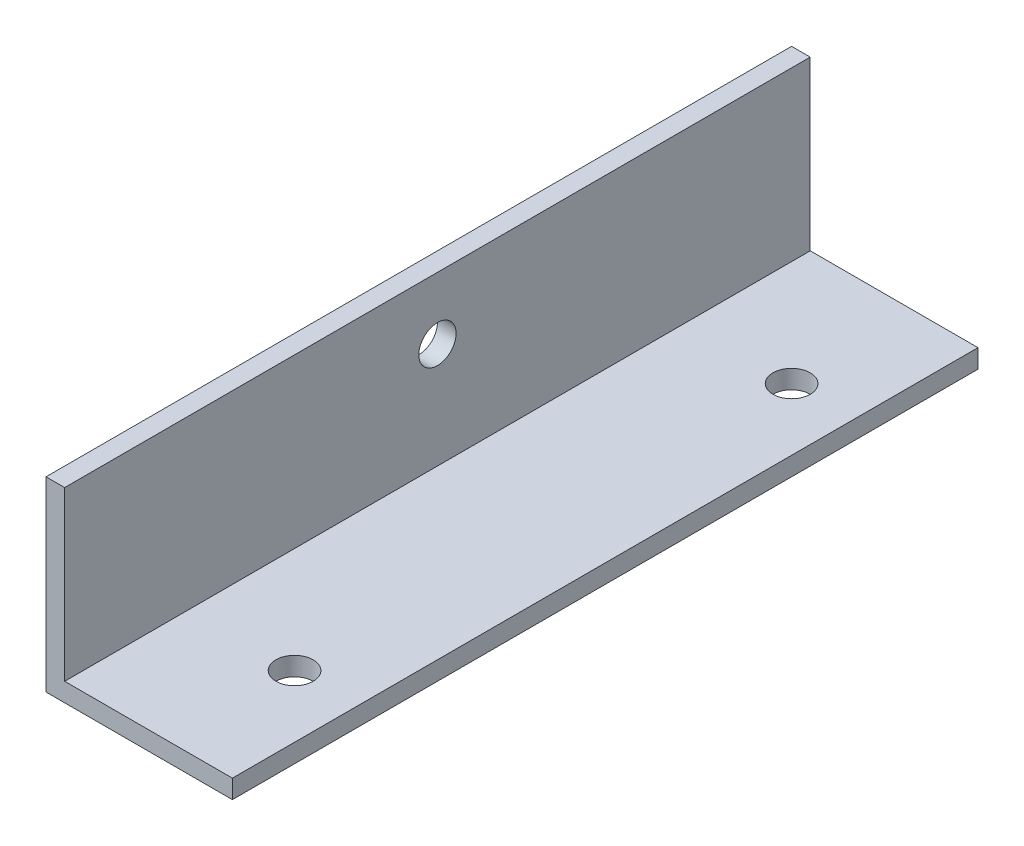
from build123d import *

# Parameters (mm, degrees)
EXTRUSION1_DEPTH           = 60
ESQUISSE2_R                = 1.5
EXTRUSION2_DEPTH           = 60
ESQUISSE3_R                = 1.5
EXTRUSION3_DEPTH           = 60
R_P_TITION_LIN_AIRE1_COUNT = 2
R_P_TITION_LIN_AIRE1_PITCH = 40


with BuildPart() as part:
    # Esquisse1 → Extrusion1 (new body)
    with BuildSketch(Plane.XY):
        Polygon((0, 0), (1.5, 0), (15, 0), (15, 1.5), (1.5, 1.5), (1.5, 15), (0, 15), align=None)
    extrude(amount=EXTRUSION1_DEPTH)

    # Esquisse2 → Extrusion2 (cut)
    with BuildSketch(Plane.ZY):
        with Locations((30, 10)):
            Circle(ESQUISSE2_R)
    extrude(amount=-EXTRUSION2_DEPTH, mode=Mode.SUBTRACT)

    # Esquisse3 → Extrusion3 (cut)
    with BuildSketch(Plane.XZ):
        with Locations(Location((10, 10, 0), (0, 0, 270))):
            Circle(ESQUISSE3_R)
    extrusion3 = extrude(amount=-EXTRUSION3_DEPTH, mode=Mode.SUBTRACT)

    # Répétition linéaire1: Extrusion3 ×2
    with Locations(*[(0, 0, i * R_P_TITION_LIN_AIRE1_PITCH) for i in range(1, R_P_TITION_LIN_AIRE1_COUNT)]):
        add(extrusion3, mode=Mode.SUBTRACT)


solid = part.part
